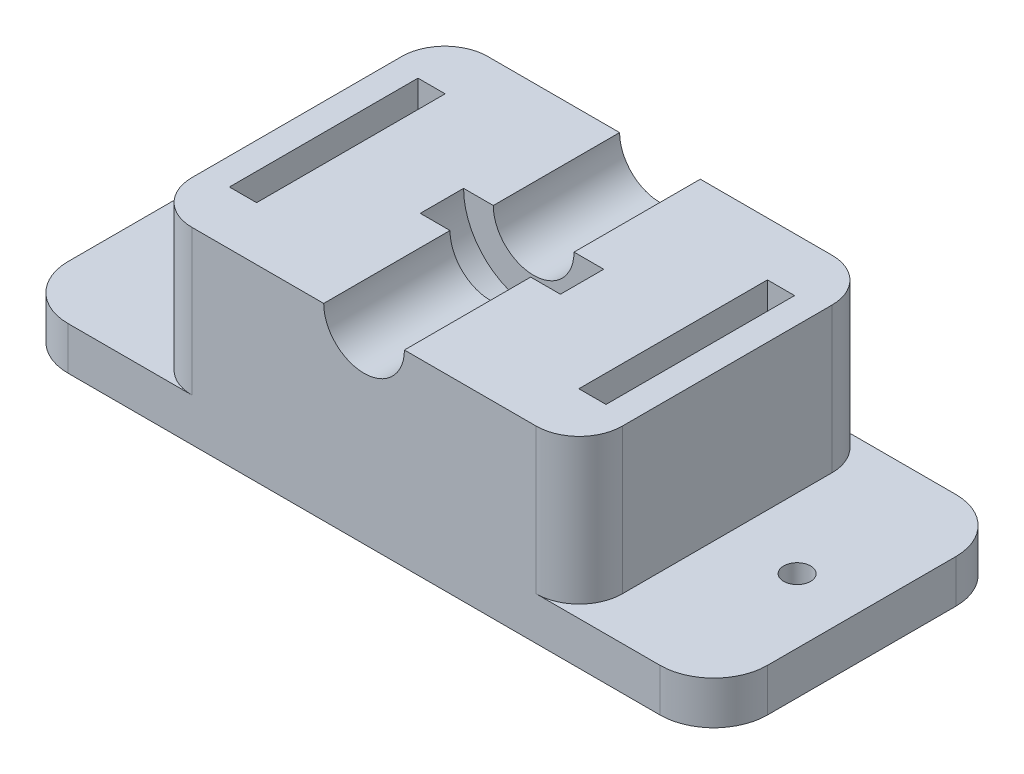
from build123d import *

# Parameters (mm, degrees)
SALIENTE_EXTRUIR1_DEPTH    = 55
CROQUIS2_R                 = 13.025
CORTAR_EXTRUIR1_DEPTH      = 4.025
CROQUIS3_W                 = 5.05
CROQUIS3_H                 = 35.05
CORTAR_EXTRUIR2_DEPTH      = 10
CORTAR_EXTRUIR3_DEPTH      = 79.779756283
CORTAR_EXTRUIR3_DEPTH_BACK = 79.779756283
CROQUIS4_R                 = 7.5
REDONDEO1_R                = 10
CROQUIS5_R                 = 2.5
CORTAR_EXTRUIR4_DEPTH      = 90.32524839
REDONDEO2_R                = 8


with BuildPart() as part:
    # Croquis1 → Saliente-Extruir1 (new body)
    with BuildSketch(Plane.XY):
        Polygon((-40, 0), (40, 0), (40, -27), (65, -27), (65, -35), (40, -35), (-40, -35), (-65, -35), (-65, -27), (-40, -27), align=None)
    extrude(amount=SALIENTE_EXTRUIR1_DEPTH)

    # Croquis2 → Cortar-Extruir1 (cut, symmetric)
    with BuildSketch(Plane.XY.offset(27.5)):
        Circle(CROQUIS2_R)
    extrude(amount=CORTAR_EXTRUIR1_DEPTH, both=True, mode=Mode.SUBTRACT)

    # Croquis3 → Cortar-Extruir2 (cut)
    with BuildSketch(Plane(origin=(0, 0, 0), x_dir=(1, 0, 0), z_dir=(0, 1, 0))):
        with Locations((-32.475, -27.5)):
            Rectangle(CROQUIS3_W, CROQUIS3_H)
        with Locations((32.475, -27.5)):
            Rectangle(CROQUIS3_W, CROQUIS3_H)
    extrude(amount=-CORTAR_EXTRUIR2_DEPTH, mode=Mode.SUBTRACT)

    # Croquis4 → Cortar-Extruir3 (cut, two sides: drawn at the far end of the back side and taken through both)
    with BuildSketch(Plane.XY.offset(27.5).offset(-CORTAR_EXTRUIR3_DEPTH_BACK)):
        Circle(CROQUIS4_R)
    extrude(amount=CORTAR_EXTRUIR3_DEPTH + CORTAR_EXTRUIR3_DEPTH_BACK, mode=Mode.SUBTRACT)

    # Redondeo1
    redondeo1_edges = [part.edges().sort_by_distance(p)[0] for p in [
        (65, -31, 0),
        (-65, -31, 0),
        (65, -31, 55),
        (-65, -31, 55),
    ]]
    fillet(redondeo1_edges, radius=REDONDEO1_R)

    # Croquis5 → Cortar-Extruir4 (cut, through all)
    with BuildSketch(Plane(origin=(0, -27, 0), x_dir=(1, 0, 0), z_dir=(0, 1, 0))):
        with Locations(Location((-53, -27.5, 0), (0, 0, 270))):
            Circle(CROQUIS5_R)
        with Locations(Location((53, -27.5, 0), (0, 0, 90))):
            Circle(CROQUIS5_R)
    extrude(amount=-CORTAR_EXTRUIR4_DEPTH, mode=Mode.SUBTRACT)

    # Redondeo2
    redondeo2_edges = [part.edges().sort_by_distance(p)[0] for p in [
        (-40, -13.5, 0),
        (40, -13.5, 0),
        (40, -13.5, 55),
        (-40, -13.5, 55),
    ]]
    fillet(redondeo2_edges, radius=REDONDEO2_R)


solid = part.part
